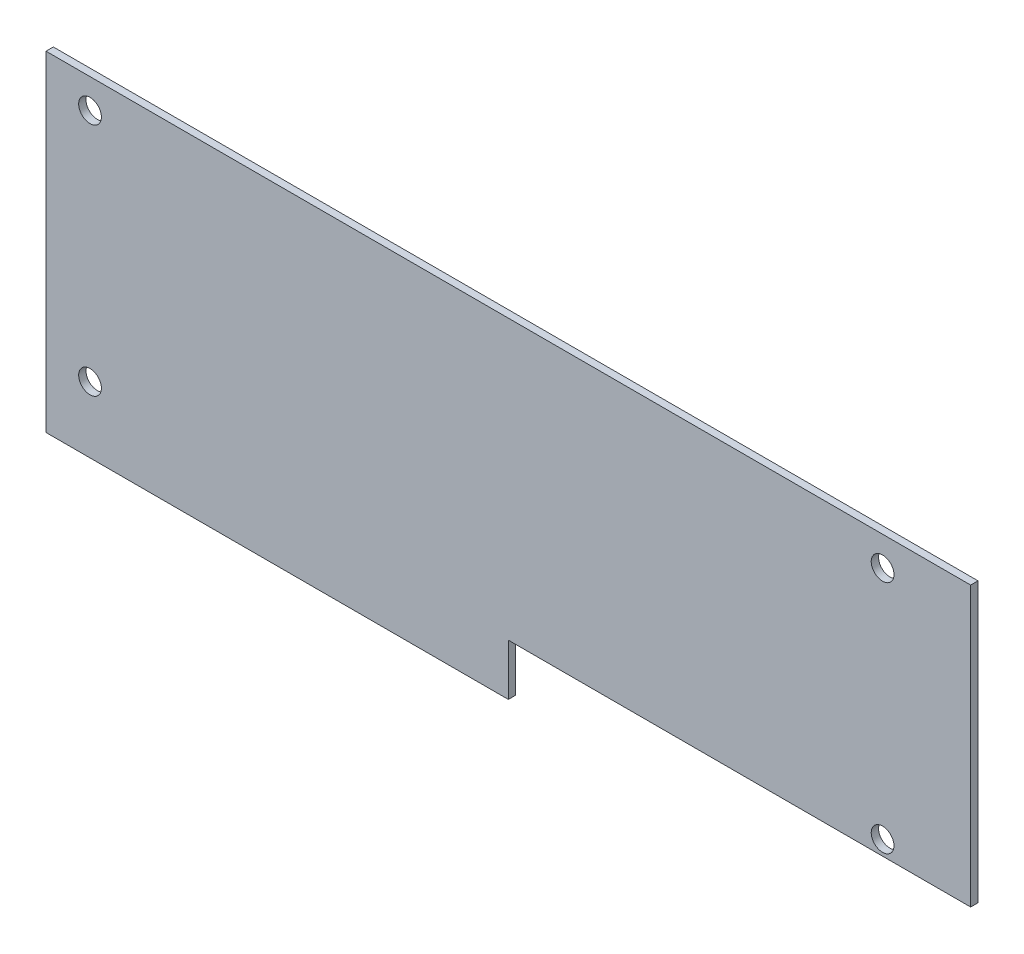
from build123d import *

# Parameters (mm, degrees)
DODANIE_WYCI_GNI_CIE1_DEPTH = 1
SZKIC2_R                    = 1.55
WYTNIJ_WYCI_GNI_CIE1_DEPTH  = 10


with BuildPart() as part:
    # Szkic1 → Dodanie-wyciągnięcie1 (new body)
    with BuildSketch(Plane.XY):
        Polygon((-118.050662271, 36.18823203), (-55.050662271, 36.18823203), (-55.050662271, 43.18823203), (7.949337729, 43.18823203), (7.949337729, 81.18823203), (-118.050662271, 81.18823203), align=None)
    extrude(amount=DODANIE_WYCI_GNI_CIE1_DEPTH)

    # Szkic2 → Wytnij-wyciągnięcie1 (cut)
    with BuildSketch(Plane.XY.offset(1)):
        with Locations((-112.050662271, 77.18823203)):
            Circle(SZKIC2_R)
        with Locations((-112.050662271, 45.18823203)):
            Circle(SZKIC2_R)
        with Locations((-4.050662271, 77.18823203)):
            Circle(SZKIC2_R)
        with Locations((-4.050662271, 45.18823203)):
            Circle(SZKIC2_R)
    extrude(amount=-WYTNIJ_WYCI_GNI_CIE1_DEPTH, mode=Mode.SUBTRACT)


solid = part.part
